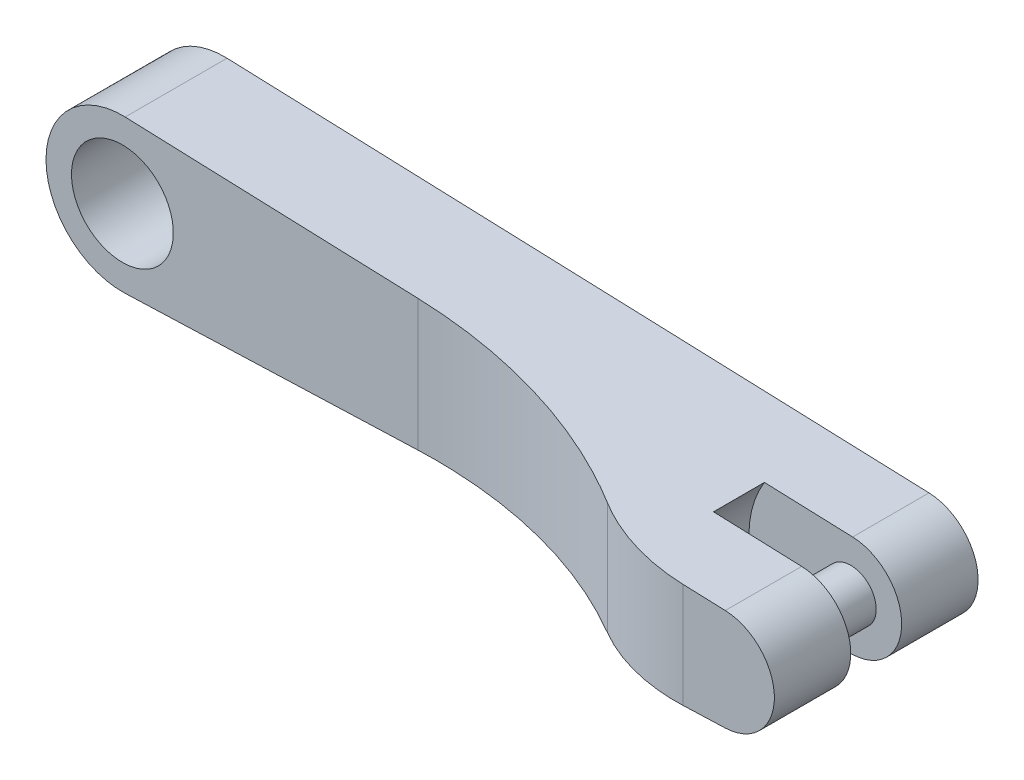
from build123d import *
from build123d.topology import SkipClean

# Parameters (mm, degrees)
SKETCH2_R                      = 50
BOSS_EXTRUDE1_DEPTH            = 50
BOSS_EXTRUDE4_START            = 100
SKETCH6_R                      = 50
BOSS_EXTRUDE4_DEPTH            = 100
CUT_EXTRUDE1_DEPTH             = 25
CUT_EXTRUDE1_DEPTH_BACK        = 25
CUT_EXTRUDE1_START             = 50
SKETCH8_R                      = 100
SKETCH8_R_2                    = 25
CUT_EXTRUDE2_REACH             = 482.234
CUT_EXTRUDE2_DIRECTION_2_REACH = 482.234
FILLET1_R                      = 200


with BuildPart() as part:
    # Sketch2 → Boss-Extrude1 (new, symmetric)
    with BuildSketch(Plane.XY):
        with BuildLine():
            Line((-287.282608696, 74.95075573), (401.811594203, 49.967170487))
            ThreePointArc((401.811594203, 49.967170487), (450, 0), (401.811594203, -49.967170487))
            Line((401.811594203, -49.967170487), (-287.282608696, -74.95075573))
            ThreePointArc((-287.282608696, -74.95075573), (-365, 0), (-287.282608696, 74.95075573))
        make_face()
        with Locations((-290, 0)):
            Circle(SKETCH2_R, mode=Mode.SUBTRACT)
    extrude(amount=BOSS_EXTRUDE1_DEPTH, both=True)

    # Sketch6 → Boss-Extrude4 (add)
    with SkipClean():  # the faces are left unmerged after this step: merging them gives an invalid solid
        with BuildSketch(Plane.XY.offset(50).offset(BOSS_EXTRUDE4_START)):
            with BuildLine():
                Line((-287.282608696, -74.95075573), (401.811594203, -49.967170487))
                ThreePointArc((401.811594203, -49.967170487), (450, 0), (401.811594203, 49.967170487))
                Line((401.811594203, 49.967170487), (-287.282608696, 74.95075573))
                ThreePointArc((-287.282608696, 74.95075573), (-365, 0), (-287.282608696, -74.95075573))
            make_face()
            with Locations((-290, 0)):
                Circle(SKETCH6_R, mode=Mode.SUBTRACT)
        extrude(amount=-BOSS_EXTRUDE4_DEPTH)

    # Sketch8 → Cut-Extrude1 (cut, two sides: drawn at the far end of the back side and taken through both)
    with SkipClean():  # the faces are left unmerged after this step: merging them gives an invalid solid
        with BuildSketch(Plane.XY.offset(CUT_EXTRUDE1_START - CUT_EXTRUDE1_DEPTH_BACK)):
            with Locations((400, 0)):
                Circle(SKETCH8_R)
            with Locations((400, 0)):
                Circle(SKETCH8_R_2, mode=Mode.SUBTRACT)
        extrude(amount=CUT_EXTRUDE1_DEPTH + CUT_EXTRUDE1_DEPTH_BACK, mode=Mode.SUBTRACT)

    # Sketch9 → Cut-Extrude2 (cut, up to next)
    with BuildSketch(Plane(origin=(0, 0, 0), x_dir=(1, 0, 0), z_dir=(0, 1, 0)), mode=Mode.PRIVATE) as cut_extrude2_sk1:
        with BuildLine():
            Line((-365, -50), (0, -50))
            ThreePointArc((0, -50), (158.113883008, -75.658350975), (300, -150))
            Line((300, -150), (-365, -150))
            Line((-365, -150), (-365, -50))
        make_face()
    cut_extrude2_tool1 = extrude(cut_extrude2_sk1.sketch, amount=-CUT_EXTRUDE2_REACH, mode=Mode.PRIVATE) & part.part
    add(cut_extrude2_tool1.solids().sort_by_distance((-76.011524, 0, 103.458826))[0], mode=Mode.SUBTRACT)

    # Sketch9 → Cut-Extrude2 direction 2 (cut, up to next)
    with BuildSketch(Plane(origin=(0, 0, 0), x_dir=(1, 0, 0), z_dir=(0, 1, 0)), mode=Mode.PRIVATE) as cut_extrude2_direction_2_sk1:
        with BuildLine():
            Line((-365, -50), (0, -50))
            ThreePointArc((0, -50), (158.113883008, -75.658350975), (300, -150))
            Line((300, -150), (-365, -150))
            Line((-365, -150), (-365, -50))
        make_face()
    cut_extrude2_direction_2_tool1 = extrude(cut_extrude2_direction_2_sk1.sketch, amount=CUT_EXTRUDE2_DIRECTION_2_REACH, mode=Mode.PRIVATE) & part.part
    add(cut_extrude2_direction_2_tool1.solids().sort_by_distance((-76.011524, 0, 103.458826))[0], mode=Mode.SUBTRACT)

    # Fillet1
    fillet1_edges = [part.edges().sort_by_distance(p)[0] for p in [
        (300, 0, 150),
    ]]
    fillet(fillet1_edges, radius=FILLET1_R)


solid = part.part
